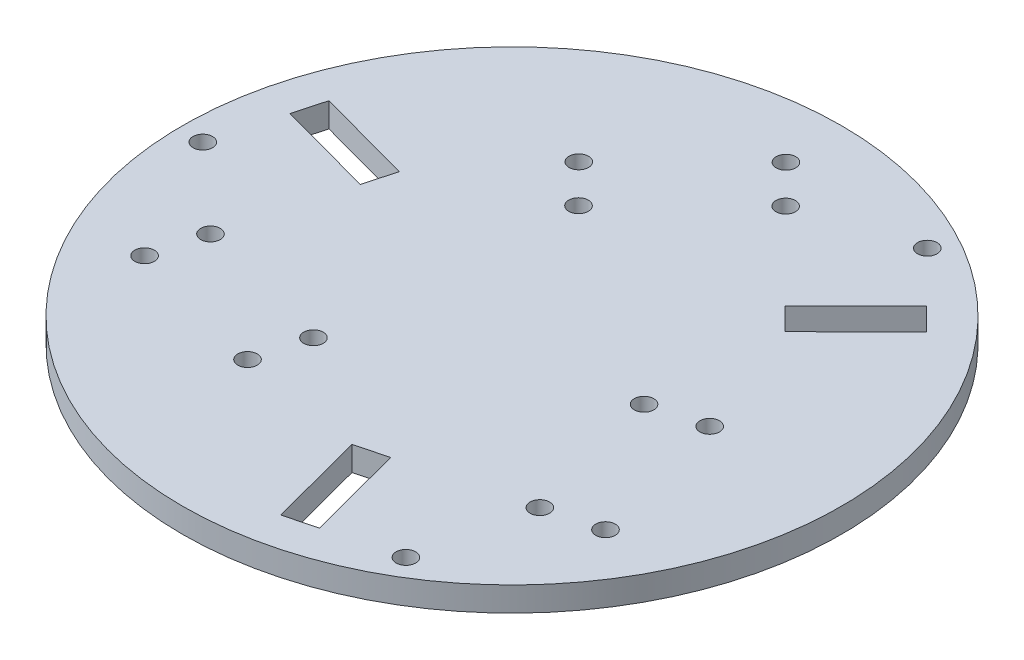
from build123d import *

# Parameters (mm, degrees)
SKETCH1_R           = 67.5
BOSS_EXTRUDE1_DEPTH = 5
CUT_EXTRUDE6_REACH  = 97.59
SKETCH7_R           = 2
CIRPATTERN1_COUNT   = 3


with BuildPart() as part:
    # Sketch1 → Boss-Extrude1 (new body)
    with BuildSketch(Plane(origin=(0, 0, 0), x_dir=(1, 0, 0), z_dir=(0, 1, 0))):
        with Locations(Location((0, 0, 0), (0, 0, 270))):
            Circle(SKETCH1_R)
    extrude(amount=BOSS_EXTRUDE1_DEPTH)

    # Sketch7 → Cut-Extrude6 (cut, up to next)
    with BuildSketch(Plane(origin=(0, 5, 0), x_dir=(1, 0, 0), z_dir=(0, 1, 0)), mode=Mode.PRIVATE) as cut_extrude6_sk1:
        with Locations(Location((0.8, 55.305278102, 0), (0, 0, 270))):
            Circle(SKETCH7_R)
    cut_extrude6_tool1 = extrude(cut_extrude6_sk1.sketch, amount=-CUT_EXTRUDE6_REACH, mode=Mode.PRIVATE) & part.part
    # Sketch7 → Cut-Extrude6 (cut, up to next)
    with BuildSketch(Plane(origin=(0, 5, 0), x_dir=(1, 0, 0), z_dir=(0, 1, 0)), mode=Mode.PRIVATE) as cut_extrude6_sk2:
        with Locations(Location((8.55097631, 47.5, 0), (0, 0, 270))):
            Circle(SKETCH7_R)
    cut_extrude6_tool2 = extrude(cut_extrude6_sk2.sketch, amount=-CUT_EXTRUDE6_REACH, mode=Mode.PRIVATE) & part.part
    # Sketch7 → Cut-Extrude6 (cut, up to next)
    with BuildSketch(Plane(origin=(0, 5, 0), x_dir=(1, 0, 0), z_dir=(0, 1, 0)), mode=Mode.PRIVATE) as cut_extrude6_sk3:
        with Locations(Location((-20.487122096, 34.166251803, 0), (0, 0, 270))):
            Circle(SKETCH7_R)
    cut_extrude6_tool3 = extrude(cut_extrude6_sk3.sketch, amount=-CUT_EXTRUDE6_REACH, mode=Mode.PRIVATE) & part.part
    # Sketch7 → Cut-Extrude6 (cut, up to next)
    with BuildSketch(Plane(origin=(0, 5, 0), x_dir=(1, 0, 0), z_dir=(0, 1, 0)), mode=Mode.PRIVATE) as cut_extrude6_sk4:
        with Locations(Location((-12.736145786, 26.360973701, 0), (0, 0, 270))):
            Circle(SKETCH7_R)
    cut_extrude6_tool4 = extrude(cut_extrude6_sk4.sketch, amount=-CUT_EXTRUDE6_REACH, mode=Mode.PRIVATE) & part.part
    # Sketch7 → Cut-Extrude6 (cut, up to next)
    with BuildSketch(Plane(origin=(0, 5, 0), x_dir=(1, 0, 0), z_dir=(0, 1, 0)), mode=Mode.PRIVATE) as cut_extrude6_sk5:
        with Locations(Location((30.523299338, 54.539693779, 0), (0, 0, 270))):
            Circle(SKETCH7_R)
    cut_extrude6_tool5 = extrude(cut_extrude6_sk5.sketch, amount=-CUT_EXTRUDE6_REACH, mode=Mode.PRIVATE) & part.part
    # Sketch7 → Cut-Extrude6 (cut, up to next)
    with BuildSketch(Plane(origin=(0, 5, 0), x_dir=(1, 0, 0), z_dir=(0, 1, 0)), mode=Mode.PRIVATE) as cut_extrude6_sk6:
        Polygon((26.155792386, 29.749769214), (40.701992485, 44.194770518), (45.282114849, 39.58256073), (30.73591475, 25.137559426), align=None)
    cut_extrude6_tool6 = extrude(cut_extrude6_sk6.sketch, amount=-CUT_EXTRUDE6_REACH, mode=Mode.PRIVATE) & part.part
    cut_extrude6_1 = cut_extrude6_tool1.solids().sort_by_distance((0.8, 5, -55.305278))[0]
    add(cut_extrude6_1, mode=Mode.SUBTRACT)
    cut_extrude6_2 = cut_extrude6_tool2.solids().sort_by_distance((8.550976, 5, -47.5))[0]
    add(cut_extrude6_2, mode=Mode.SUBTRACT)
    cut_extrude6_3 = cut_extrude6_tool3.solids().sort_by_distance((-20.487122, 5, -34.166252))[0]
    add(cut_extrude6_3, mode=Mode.SUBTRACT)
    cut_extrude6_4 = cut_extrude6_tool4.solids().sort_by_distance((-12.736146, 5, -26.360974))[0]
    add(cut_extrude6_4, mode=Mode.SUBTRACT)
    cut_extrude6_5 = cut_extrude6_tool5.solids().sort_by_distance((30.523299, 5, -54.539694))[0]
    add(cut_extrude6_5, mode=Mode.SUBTRACT)
    cut_extrude6_6 = cut_extrude6_tool6.solids().sort_by_distance((35.718954, 5, -34.666165))[0]
    add(cut_extrude6_6, mode=Mode.SUBTRACT)
    cut_extrude6 = cut_extrude6_1 + cut_extrude6_2 + cut_extrude6_3 + cut_extrude6_4 + cut_extrude6_5 + cut_extrude6_6  # Cut-Extrude6 as one shape, for the pattern or mirror that repeats it

    # CirPattern1: Cut-Extrude6 ×3 about axis
    cirpattern1_axis = Axis((0, 0, 0), (0, 1, 0))
    for i in range(1, CIRPATTERN1_COUNT):
        add(cut_extrude6.rotate(cirpattern1_axis, i * 360 / CIRPATTERN1_COUNT), mode=Mode.SUBTRACT)


solid = part.part
